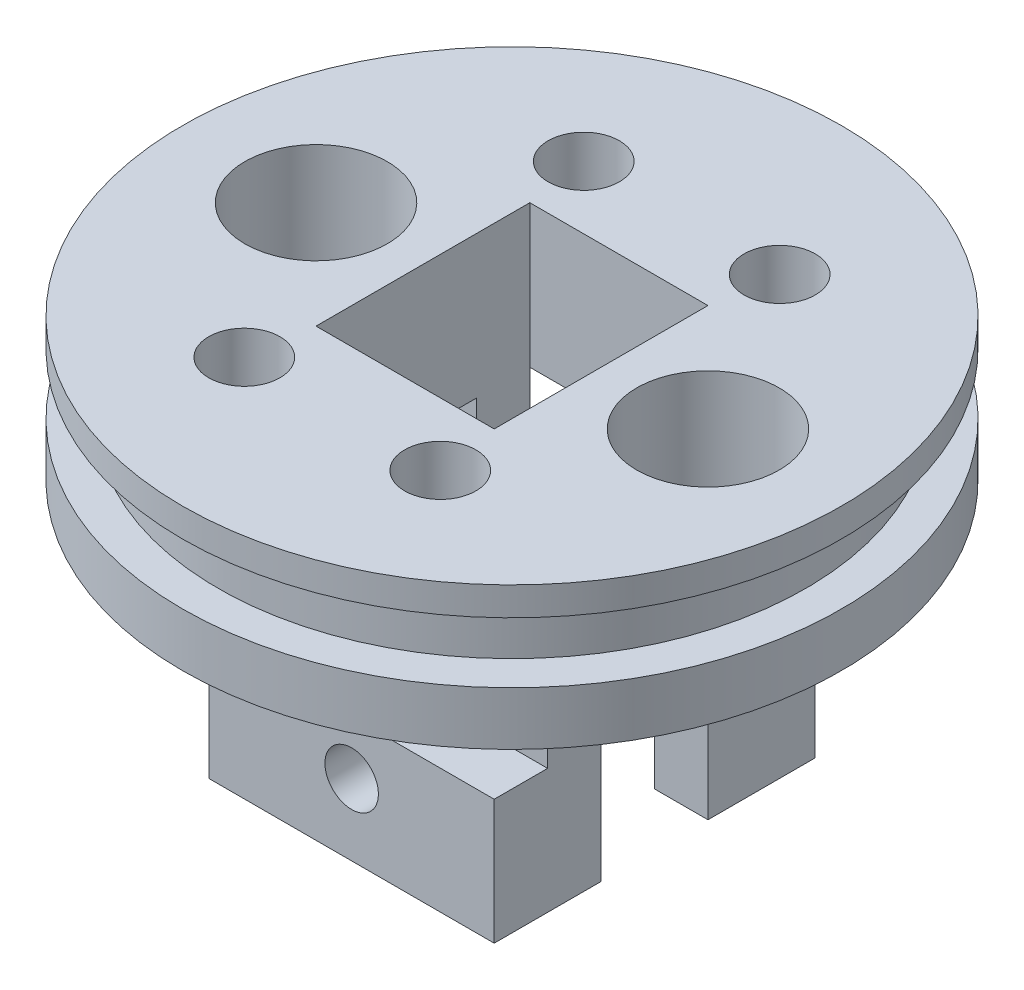
from build123d import *

# Parameters (mm, degrees)
SKETCH_1_R               = 11
EXTRUDE_1_DEPTH          = 9
SKETCH_2_R               = 1
CUT_EXTRUDE_1_DEPTH      = 10
SKETCH_3_R               = 16.549134696
SKETCH_3_R_2             = 9.25
CUT_EXTRUDE_2_DEPTH      = 7
SKETCH_4_W               = 2
SKETCH_4_H               = 1.7
SKETCH_5_W               = 5
SKETCH_5_H               = 6
CUT_EXTRUDE_3_DEPTH      = 7
SKETCH_6_R               = 1.4
CUT_EXTRUDE_4_DEPTH      = 7
PATTERN_CIRCULAR_1_COUNT = 3
PATTERN_CIRCULAR_1_ANGLE = 120
SKETCH_10_R              = 17.755262973
CUT_EXTRUDE_8_DEPTH      = 5
SKETCH_11_R              = 2
CUT_EXTRUDE_9_DEPTH      = 3
SKETCH_12_W              = 1.5
SKETCH_12_H              = 1.5
EXTRUDE_2_DEPTH          = 3.5
SKETCH_14_W              = 1.5
SKETCH_14_H              = 1.5
EXTRUDE_3_DEPTH          = 3.5
SKETCH_13_R              = 0.75
CUT_EXTRUDE_11_DEPTH     = 18.989580318


with BuildPart() as part:
    # 草图1 → 凸台-拉伸1 (new body)
    with BuildSketch(Plane(origin=(0, 0, 0), x_dir=(1, 0, 0), z_dir=(0, 1, 0))):
        with Locations(Location((0, 0, 0), (0, 0, 270))):
            Circle(SKETCH_1_R)
    extrude(amount=EXTRUDE_1_DEPTH)

    # 草图2 → 切除-拉伸1 (cut)
    with BuildSketch(Plane(origin=(0, 9, 0), x_dir=(1, 0, 0), z_dir=(0, 1, 0))):
        with Locations(Location((-5.5, 0, 0), (0, 0, 270))):
            Circle(SKETCH_2_R)
        with Locations(Location((5.5, 0, 0), (0, 0, 270))):
            Circle(SKETCH_2_R)
    cut_extrude_1 = extrude(amount=-CUT_EXTRUDE_1_DEPTH, mode=Mode.SUBTRACT)

    # 草图3 → 切除-拉伸2 (cut)
    with BuildSketch(Plane.XZ):
        Circle(SKETCH_3_R)
        with Locations(Location((0, 0, 0), (0, 0, 270))):
            Circle(SKETCH_3_R_2, mode=Mode.SUBTRACT)
    extrude(amount=-CUT_EXTRUDE_2_DEPTH, mode=Mode.SUBTRACT)

    # 草图4 → 切除-旋转1 (revolve, cut)
    with BuildSketch(Plane.XY, mode=Mode.PRIVATE) as cut_revolve_1_sk:
        with Locations((-9.25, 5.45)):
            Rectangle(SKETCH_4_W, SKETCH_4_H)
        with Locations((-9.25, 2.35)):
            Rectangle(SKETCH_4_W, SKETCH_4_H)
    revolve(cut_revolve_1_sk.sketch.rotate(Axis((0, 0, 0), (0, 1, 0)), 270), axis=Axis((0, 0, 0), (0, 1, 0)), mode=Mode.SUBTRACT)

    # 草图5 → 切除-拉伸3 (cut)
    with BuildSketch(Plane.XZ):
        Rectangle(SKETCH_5_W, SKETCH_5_H)
    extrude(amount=-CUT_EXTRUDE_3_DEPTH, mode=Mode.SUBTRACT)

    # 草图6 → 切除-拉伸4 (cut)
    with BuildSketch(Plane(origin=(0, 9, 0), x_dir=(1, 0, 0), z_dir=(0, 1, 0))):
        with Locations(Location((0, 0, 0), (0, 0, 270))):
            Circle(SKETCH_6_R)
    extrude(amount=-CUT_EXTRUDE_4_DEPTH, mode=Mode.SUBTRACT)

    # 阵列(圆周)1: 切除-拉伸1 ×3 about axis
    pattern_circular_1_axis = Axis((0, 0, 0), (0, -1, 0))
    for i in range(1, PATTERN_CIRCULAR_1_COUNT):
        add(cut_extrude_1.rotate(pattern_circular_1_axis, i * PATTERN_CIRCULAR_1_ANGLE / (PATTERN_CIRCULAR_1_COUNT - 1)), mode=Mode.SUBTRACT)

    # 草图10 → 切除-拉伸8 (cut)
    with BuildSketch(Plane(origin=(0, 9, 0), x_dir=(1, 0, 0), z_dir=(0, 1, 0))):
        Circle(SKETCH_10_R)
    extrude(amount=-CUT_EXTRUDE_8_DEPTH, mode=Mode.SUBTRACT)

    # 草图11 → 切除-拉伸9 (cut)
    with BuildSketch(Plane(origin=(0, 4, 0), x_dir=(1, 0, 0), z_dir=(0, 1, 0))):
        with Locations(Location((-5.5, 0, 0), (0, 0, 270))):
            Circle(SKETCH_11_R)
        with Locations(Location((5.5, 0, 0), (0, 0, 270))):
            Circle(SKETCH_11_R)
    extrude(amount=-CUT_EXTRUDE_9_DEPTH, mode=Mode.SUBTRACT)

    # 草图12 → 凸台-拉伸2 (add)
    with BuildSketch(Plane.XZ):
        with Locations((-3.25, 2.25)):
            Rectangle(SKETCH_12_W, SKETCH_12_H)
        with Locations((3.25, 2.25)):
            Rectangle(SKETCH_12_W, SKETCH_12_H)
        with Locations((3.25, -2.25)):
            Rectangle(SKETCH_12_W, SKETCH_12_H)
        with Locations((-3.25, -2.25)):
            Rectangle(SKETCH_12_W, SKETCH_12_H)
    extrude(amount=EXTRUDE_2_DEPTH)

    # 草图14 → 凸台-拉伸3 (add)
    with BuildSketch(Plane.XZ.offset(3.5)):
        Polygon((-4, 4.5), (-4, 3), (-2.5, 3), (2.5, 3), (2.5, 1.5), (4, 1.5), (4, 4.5), align=None)
        with Locations((-3.25, 2.25)):
            Rectangle(SKETCH_14_W, SKETCH_14_H)
        Polygon((-2.5, -3), (-2.5, -1.5), (-4, -1.5), (-4, -4.5), (4, -4.5), (4, -1.5), (2.5, -1.5), (2.5, -3), align=None)
    extrude(amount=EXTRUDE_3_DEPTH)

    # 草图13 → 切除-拉伸11 (cut, through all)
    with BuildSketch(Plane(origin=(0, 0, 4.5), x_dir=(-1, 0, 0), z_dir=(0, 0, -1))):
        with Locations(Location((0, -5, 0), (0, 0, 180))):
            Circle(SKETCH_13_R)
    extrude(amount=CUT_EXTRUDE_11_DEPTH, mode=Mode.SUBTRACT)


solid = part.part
